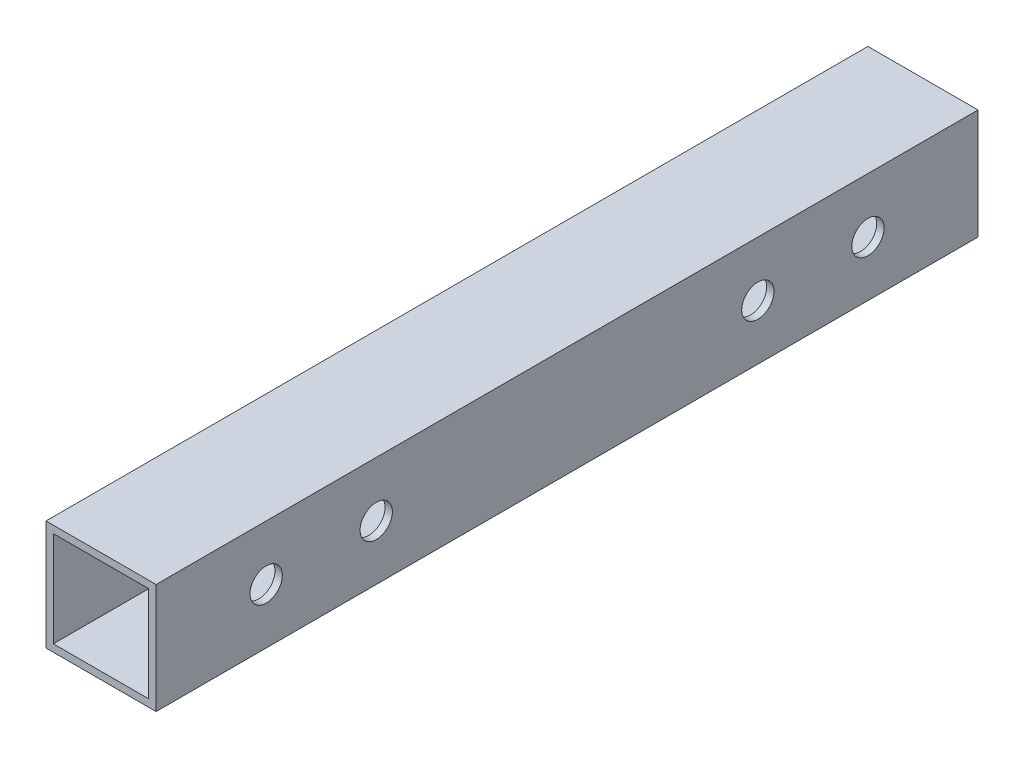
from build123d import *

# Parameters (mm, degrees)
SKETCH_1_W          = 15
SKETCH_1_H          = 15
SKETCH_1_W_2        = 13
SKETCH_1_H_2        = 13
EXTRUDE_1_DEPTH     = 112
SKETCH_3_R          = 2.2
CUT_EXTRUDE_1_DEPTH = 55


with BuildPart() as part:
    # 草图1 → 凸台-拉伸1 (new body)
    with BuildSketch(Plane.XY):
        Rectangle(SKETCH_1_W, SKETCH_1_H)
        Rectangle(SKETCH_1_W_2, SKETCH_1_H_2, mode=Mode.SUBTRACT)
    extrude(amount=EXTRUDE_1_DEPTH)

    # 草图3 → 切除-拉伸1 (cut)
    with BuildSketch(Plane(origin=(7.5, 0, 0), x_dir=(0, 0, -1), z_dir=(1, 0, 0))):
        with Locations((-15, 0)):
            Circle(SKETCH_3_R)
        with Locations((-30, 0)):
            Circle(SKETCH_3_R)
        with Locations((-97, 0)):
            Circle(SKETCH_3_R)
        with Locations((-82, 0)):
            Circle(SKETCH_3_R)
    extrude(amount=-CUT_EXTRUDE_1_DEPTH, mode=Mode.SUBTRACT)


solid = part.part
